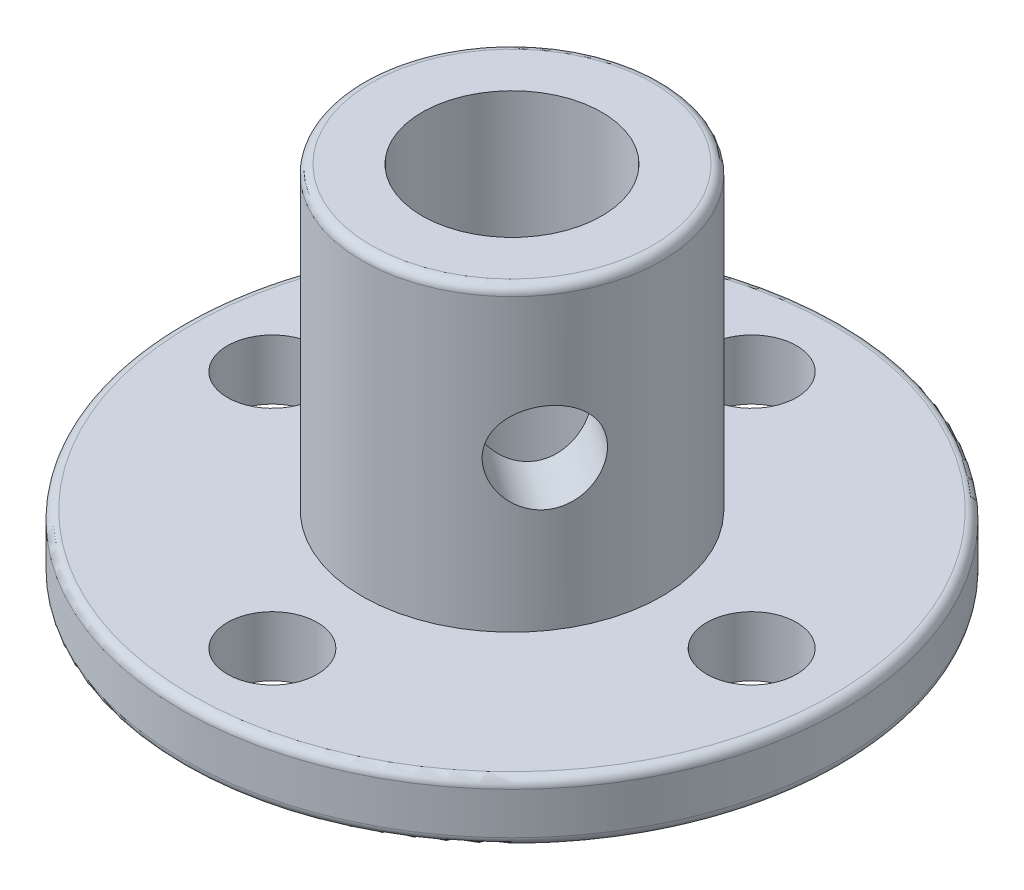
from build123d import *

# Parameters (mm, degrees)
SKETCH1_R           = 5
BOSS_EXTRUDE2_DEPTH = 12
SKETCH3_R           = 11
BOSS_EXTRUDE3_DEPTH = 2
SKETCH4_R           = 3
CUT_EXTRUDE1_DEPTH  = 12
SKETCH5_R           = 1.5
CUT_EXTRUDE2_DEPTH  = 2
FILLET1_R           = 0.3
SKETCH7_R           = 1.5
CUT_EXTRUDE3_DEPTH  = 4


with BuildPart() as part:
    # Sketch1 → Boss-Extrude2 (new body)
    with BuildSketch(Plane(origin=(0, 0, 0), x_dir=(1, 0, 0), z_dir=(0, 1, 0))):
        with Locations(Location((0, 0, 0), (0, 0, 270))):
            Circle(SKETCH1_R)
    extrude(amount=BOSS_EXTRUDE2_DEPTH)

    # Sketch3 → Boss-Extrude3 (add)
    with BuildSketch(Plane(origin=(0, 0, 0), x_dir=(1, 0, 0), z_dir=(0, 1, 0))):
        with Locations(Location((0, 0, 0), (0, 0, 270))):
            Circle(SKETCH3_R)
    extrude(amount=BOSS_EXTRUDE3_DEPTH)

    # Sketch4 → Cut-Extrude1 (cut)
    with BuildSketch(Plane(origin=(0, 0, 0), x_dir=(1, 0, 0), z_dir=(0, 1, 0))):
        with Locations(Location((0, 0, 0), (0, 0, 270))):
            Circle(SKETCH4_R)
    extrude(amount=CUT_EXTRUDE1_DEPTH, mode=Mode.SUBTRACT)

    # Sketch5 → Cut-Extrude2 (cut)
    with BuildSketch(Plane(origin=(0, 2, 0), x_dir=(1, 0, 0), z_dir=(0, 1, 0))):
        with Locations(Location((0, 8, 0), (0, 0, 270))):
            Circle(SKETCH5_R)
        with Locations(Location((8, 0, 0), (0, 0, 270))):
            Circle(SKETCH5_R)
        with Locations(Location((0, -8, 0), (0, 0, 270))):
            Circle(SKETCH5_R)
        with Locations(Location((-8, 0, 0), (0, 0, 270))):
            Circle(SKETCH5_R)
    extrude(amount=-CUT_EXTRUDE2_DEPTH, mode=Mode.SUBTRACT)

    # Fillet1
    fillet1_edges = [part.edges().sort_by_distance(p)[0] for p in [
        (0, 12, -5),
        (0, 0, -11),
        (0, 2, -11),
    ]]
    fillet(fillet1_edges, radius=FILLET1_R)

    # Sketch7 → Cut-Extrude3 (cut)
    with BuildSketch(Plane(origin=(4.0625, 0, 2.914805954), x_dir=(0.5829611908180293, 0, -0.8125000000000155), z_dir=(0.8125000000000155, 0, 0.5829611908180293))):
        with Locations((0, 7)):
            Circle(SKETCH7_R)
    extrude(amount=-CUT_EXTRUDE3_DEPTH, mode=Mode.SUBTRACT)


solid = part.part
